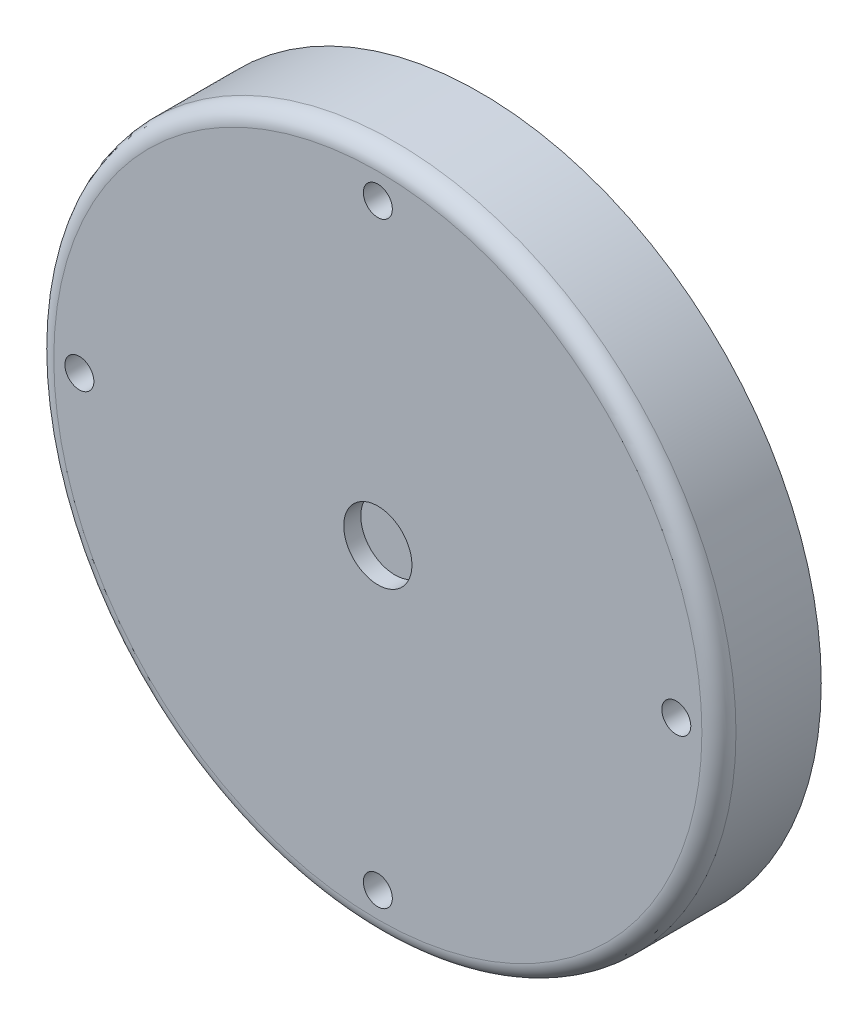
from build123d import *

# Parameters (mm, degrees)
SZKIC1_R                        = 100
DODANIE_WYCI_GNI_CIE2_DEPTH     = 5
SZKIC2_R                        = 100
SZKIC2_R_2                      = 75
DODANIE_WYCI_GNI_CIE3_DEPTH     = 20
ZAOKR_GLENIE1_R                 = 5
SZKIC4_R                        = 10
WYTNIJ_WYCI_GNI_CIE2_DEPTH      = 5
WYTNIJ_WYCI_GNI_CIE3_DEPTH      = 145.568323017
WYTNIJ_WYCI_GNI_CIE3_DEPTH_BACK = 145.568323017
SZKIC3_R                        = 4.25
SZKIC5_W                        = 6
SZKIC5_H                        = 6
SZKIC6_R                        = 0.6
WYTNIJ_WYCI_GNI_CIE4_DEPTH      = 3


with BuildPart() as part:
    # Szkic1 → Dodanie-wyciągnięcie2 (new, symmetric)
    with BuildSketch(Plane.XY):
        Circle(SZKIC1_R)
    extrude(amount=DODANIE_WYCI_GNI_CIE2_DEPTH, both=True)

    # Szkic2 → Dodanie-wyciągnięcie3 (add)
    with BuildSketch(Plane(origin=(0, 0, -5), x_dir=(-1, 0, 0), z_dir=(0, 0, -1))):
        Circle(SZKIC2_R)
        Circle(SZKIC2_R_2, mode=Mode.SUBTRACT)
    extrude(amount=DODANIE_WYCI_GNI_CIE3_DEPTH)

    # Zaokrąglenie1
    zaokr_glenie1_edges = [part.edges().sort_by_distance(p)[0] for p in [
        (-100, 0, 5),
    ]]
    fillet(zaokr_glenie1_edges, radius=ZAOKR_GLENIE1_R)

    # Szkic4 → Wytnij-wyciągnięcie2 (cut)
    with BuildSketch(Plane.XY.offset(5)):
        Circle(SZKIC4_R)
    extrude(amount=-WYTNIJ_WYCI_GNI_CIE2_DEPTH, mode=Mode.SUBTRACT)

    # Szkic3 → Wytnij-wyciągnięcie3 (cut, two sides: drawn at the far end of the back side and taken through both)
    with BuildSketch(Plane.XY.offset(5).offset(-WYTNIJ_WYCI_GNI_CIE3_DEPTH_BACK)):
        with Locations((87.5, 0)):
            Circle(SZKIC3_R)
        with Locations((0, 87.5)):
            Circle(SZKIC3_R)
        with Locations((0, -87.5)):
            Circle(SZKIC3_R)
        with Locations((-87.5, 0)):
            Circle(SZKIC3_R)
    extrude(amount=WYTNIJ_WYCI_GNI_CIE3_DEPTH + WYTNIJ_WYCI_GNI_CIE3_DEPTH_BACK, mode=Mode.SUBTRACT)

    # Szkic5 → Wycięcie-obrót1 (revolve, cut)
    with BuildSketch(Plane(origin=(0, 0, 0), x_dir=(1, 0, 0), z_dir=(0, 1, 0)), mode=Mode.PRIVATE) as wyci_cie_obr_t1_sk:
        with Locations((-78, 13)):
            Rectangle(SZKIC5_W, SZKIC5_H)
    revolve(wyci_cie_obr_t1_sk.sketch.rotate(Axis((0, 0, 17.369843618), (0, 0, -1)), 180), axis=Axis((0, 0, 17.369843618), (0, 0, -1)), mode=Mode.SUBTRACT)

    # Szkic6 → Wytnij-wyciągnięcie4 (cut)
    with BuildSketch(Plane(origin=(0, 0, -5), x_dir=(-1, 0, 0), z_dir=(0, 0, -1))):
        with Locations((0, -64)):
            Circle(SZKIC6_R)
        with Locations((-64, 0)):
            Circle(SZKIC6_R)
        with Locations((0, 64)):
            Circle(SZKIC6_R)
        with Locations((64, 0)):
            Circle(SZKIC6_R)
    extrude(amount=-WYTNIJ_WYCI_GNI_CIE4_DEPTH, mode=Mode.SUBTRACT)


solid = part.part
